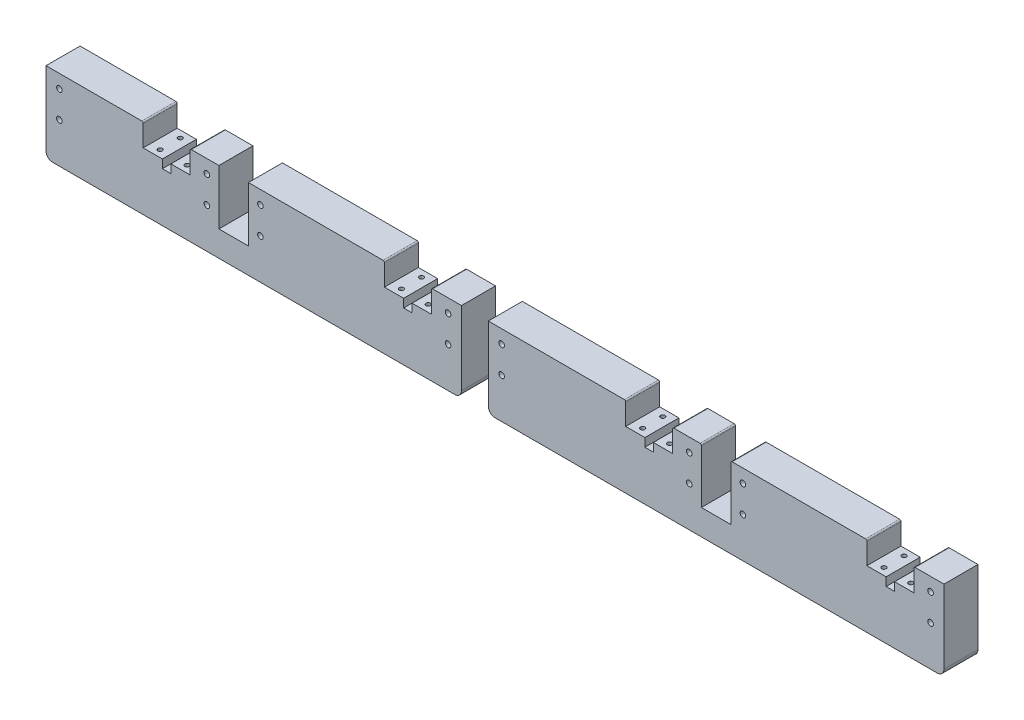
from build123d import *

# Parameters (mm, degrees)
BOSS_EXTRUDE1_DEPTH                  = 25.4
TAP_DRILL_FOR_M4X0_7_TAP1_AT_2_COUNT = 2
TAP_DRILL_FOR_M4X0_7_TAP1_AT_2_PITCH = 20
TAP_DRILL_FOR_M4X0_7_TAP1_AT_3_COUNT = 2
TAP_DRILL_FOR_M4X0_7_TAP1_AT_3_PITCH = 15
TAP_DRILL_FOR_M4X0_7_TAP1_AT_4_COUNT = 2
TAP_DRILL_FOR_M4X0_7_TAP1_AT_4_PITCH = 25
TAP_DRILL_FOR_M5X0_8_TAP3_D          = 4.2
LPATTERN5_COUNT                      = 4
LPATTERN5_PITCH                      = 180
CUT_EXTRUDE1_REACH                   = 643.752
SKETCH11_W                           = 50
SKETCH11_H                           = 60
SKETCH11_R                           = 2.1
SKETCH11_W_2                         = 22
SKETCH11_H_2                         = 42
CUT_EXTRUDE3_REACH                   = 593.9
SKETCH13_W                           = 20
SKETCH13_H                           = 10
SKETCH13_H_2                         = 50
FILLET1_R                            = 1
FILLET4_R                            = 1
FILLET2_R                            = 5
FILLET3_R                            = 5


with BuildPart() as part:
    # Sketch1 → Boss-Extrude1 (new body)
    with BuildSketch(Plane.XY):
        Polygon((22.5, 40), (-122.5, 40), (-122.5, 23.125), (-136.825, 23.125), (-136.825, 16.825), (-143.175, 16.825), (-143.175, 23.125), (-157.5, 23.125), (-157.5, 40), (-302.5, 40), (-302.5, 23.125), (-316.825, 23.125), (-316.825, 16.825), (-323.175, 16.825), (-323.175, 23.125), (-337.5, 23.125), (-337.5, 40), (-482.5, 40), (-482.5, 23.125), (-496.825, 23.125), (-496.825, 16.825), (-503.175, 16.825), (-503.175, 23.125), (-517.5, 23.125), (-517.5, 40), (-640, 40), (-640, -20), (80, -20), (80, 40), (57.5, 40), (57.5, 23.125), (43.175, 23.125), (43.175, 16.825), (36.825, 16.825), (36.825, 23.125), (22.5, 23.125), align=None)
    extrude(amount=-BOSS_EXTRUDE1_DEPTH)

    # Sketch9 → Tap Drill for M4x0.7 Tap1 (revolve, cut)
    with BuildSketch(Plane(origin=(30, 23.125, -5.2), x_dir=(0, 0, 1), z_dir=(1, 0, 0))):
        Polygon((0, 0), (0, 5.991420021), (1.65, 5), (1.65, 0), align=None)
    tap_drill_for_m4x0_7_tap1 = revolve(axis=Axis((30, 29.475, -5.2), (0, -1, 0)), mode=Mode.SUBTRACT)

    # Tap Drill for M4x0.7 Tap1 at 2: Tap Drill for M4x0.7 Tap1 ×2
    with Locations(*[(i * TAP_DRILL_FOR_M4X0_7_TAP1_AT_2_PITCH, 0, 0) for i in range(1, TAP_DRILL_FOR_M4X0_7_TAP1_AT_2_COUNT)]):
        add(tap_drill_for_m4x0_7_tap1, mode=Mode.SUBTRACT)

    # Tap Drill for M4x0.7 Tap1 at 3: Tap Drill for M4x0.7 Tap1 ×2
    with Locations(*[(0, 0, -i * TAP_DRILL_FOR_M4X0_7_TAP1_AT_3_PITCH) for i in range(1, TAP_DRILL_FOR_M4X0_7_TAP1_AT_3_COUNT)]):
        add(tap_drill_for_m4x0_7_tap1, mode=Mode.SUBTRACT)

    # Tap Drill for M4x0.7 Tap1 at 4: Tap Drill for M4x0.7 Tap1 ×2
    with Locations(*[Vector(0.8, 0, -0.6) * (i * TAP_DRILL_FOR_M4X0_7_TAP1_AT_4_PITCH) for i in range(1, TAP_DRILL_FOR_M4X0_7_TAP1_AT_4_COUNT)]):
        add(tap_drill_for_m4x0_7_tap1, mode=Mode.SUBTRACT)

    # Tap Drill for M5x0.8 Tap3 (through all)
    with Locations(Plane(origin=(-70, 30, 0), x_dir=(1, 0, 0), z_dir=(0, 0, 1))):
        with Locations((0, 0), (0, -20), (140, -20), (140, 0)):
            tap_drill_for_m5x0_8_tap3 = Hole(TAP_DRILL_FOR_M5X0_8_TAP3_D / 2)

    # LPattern5: Tap Drill for M4x0.7 Tap1, Tap Drill for M5x0.8 Tap3 ×4
    with Locations(*[(-i * LPATTERN5_PITCH, 0, 0) for i in range(1, LPATTERN5_COUNT)]):
        add(tap_drill_for_m4x0_7_tap1, mode=Mode.SUBTRACT)
        add(tap_drill_for_m5x0_8_tap3, mode=Mode.SUBTRACT)

    # LPattern5 copy 1 sketch → LPattern5 copy 1 (revolve, cut)
    with BuildSketch(Plane(origin=(-130, 23.125, -5.2), x_dir=(0, 0, 1), z_dir=(1, 0, 0))):
        Polygon((0, 0), (0, 5.991420021), (1.65, 5), (1.65, 0), align=None)
    revolve(axis=Axis((-130, 29.475, -5.2), (0, -1, 0)), mode=Mode.SUBTRACT)

    # LPattern5 copy 2 sketch → LPattern5 copy 2 (revolve, cut)
    with BuildSketch(Plane(origin=(-310, 23.125, -5.2), x_dir=(0, 0, 1), z_dir=(1, 0, 0))):
        Polygon((0, 0), (0, 5.991420021), (1.65, 5), (1.65, 0), align=None)
    revolve(axis=Axis((-310, 29.475, -5.2), (0, -1, 0)), mode=Mode.SUBTRACT)

    # LPattern5 copy 3 sketch → LPattern5 copy 3 (revolve, cut)
    with BuildSketch(Plane(origin=(-490, 23.125, -5.2), x_dir=(0, 0, 1), z_dir=(1, 0, 0))):
        Polygon((0, 0), (0, 5.991420021), (1.65, 5), (1.65, 0), align=None)
    revolve(axis=Axis((-490, 29.475, -5.2), (0, -1, 0)), mode=Mode.SUBTRACT)

    # LPattern5 copy 4 sketch → LPattern5 copy 4 (revolve, cut)
    with BuildSketch(Plane(origin=(-150, 23.125, -20.2), x_dir=(0, 0, 1), z_dir=(1, 0, 0))):
        Polygon((0, 0), (0, 5.991420021), (1.65, 5), (1.65, 0), align=None)
    revolve(axis=Axis((-150, 29.475, -20.2), (0, -1, 0)), mode=Mode.SUBTRACT)

    # LPattern5 copy 5 sketch → LPattern5 copy 5 (revolve, cut)
    with BuildSketch(Plane(origin=(-330, 23.125, -20.2), x_dir=(0, 0, 1), z_dir=(1, 0, 0))):
        Polygon((0, 0), (0, 5.991420021), (1.65, 5), (1.65, 0), align=None)
    revolve(axis=Axis((-330, 29.475, -20.2), (0, -1, 0)), mode=Mode.SUBTRACT)

    # LPattern5 copy 6 sketch → LPattern5 copy 6 (revolve, cut)
    with BuildSketch(Plane(origin=(-510, 23.125, -20.2), x_dir=(0, 0, 1), z_dir=(1, 0, 0))):
        Polygon((0, 0), (0, 5.991420021), (1.65, 5), (1.65, 0), align=None)
    revolve(axis=Axis((-510, 29.475, -20.2), (0, -1, 0)), mode=Mode.SUBTRACT)

    # LPattern5 copy 7 sketch → LPattern5 copy 7 (revolve, cut)
    with BuildSketch(Plane(origin=(-130, 23.125, -20.2), x_dir=(0, 0, 1), z_dir=(1, 0, 0))):
        Polygon((0, 0), (0, 5.991420021), (1.65, 5), (1.65, 0), align=None)
    revolve(axis=Axis((-130, 29.475, -20.2), (0, -1, 0)), mode=Mode.SUBTRACT)

    # LPattern5 copy 8 sketch → LPattern5 copy 8 (revolve, cut)
    with BuildSketch(Plane(origin=(-310, 23.125, -20.2), x_dir=(0, 0, 1), z_dir=(1, 0, 0))):
        Polygon((0, 0), (0, 5.991420021), (1.65, 5), (1.65, 0), align=None)
    revolve(axis=Axis((-310, 29.475, -20.2), (0, -1, 0)), mode=Mode.SUBTRACT)

    # LPattern5 copy 9 sketch → LPattern5 copy 9 (revolve, cut)
    with BuildSketch(Plane(origin=(-490, 23.125, -20.2), x_dir=(0, 0, 1), z_dir=(1, 0, 0))):
        Polygon((0, 0), (0, 5.991420021), (1.65, 5), (1.65, 0), align=None)
    revolve(axis=Axis((-490, 29.475, -20.2), (0, -1, 0)), mode=Mode.SUBTRACT)

    # Sketch11 → Cut-Extrude1 (cut, up to next)
    with BuildSketch(Plane.XY, mode=Mode.PRIVATE) as cut_extrude1_sk1:
        with Locations((-615, 10)):
            Rectangle(SKETCH11_W, SKETCH11_H)
    cut_extrude1_tool1 = extrude(cut_extrude1_sk1.sketch, amount=-CUT_EXTRUDE1_REACH, mode=Mode.PRIVATE) & part.part
    # Sketch11 → Cut-Extrude1 (cut, up to next)
    with BuildSketch(Plane.XY, mode=Mode.PRIVATE) as cut_extrude1_sk2:
        with Locations((-580, 30)):
            Circle(SKETCH11_R)
    cut_extrude1_tool2 = extrude(cut_extrude1_sk2.sketch, amount=-CUT_EXTRUDE1_REACH, mode=Mode.PRIVATE) & part.part
    # Sketch11 → Cut-Extrude1 (cut, up to next)
    with BuildSketch(Plane.XY, mode=Mode.PRIVATE) as cut_extrude1_sk3:
        with Locations((-580, 10)):
            Circle(SKETCH11_R)
    cut_extrude1_tool3 = extrude(cut_extrude1_sk3.sketch, amount=-CUT_EXTRUDE1_REACH, mode=Mode.PRIVATE) & part.part
    # Sketch11 → Cut-Extrude1 (cut, up to next)
    with BuildSketch(Plane.XY, mode=Mode.PRIVATE) as cut_extrude1_sk4:
        with Locations((-90, 20)):
            Rectangle(SKETCH11_W_2, SKETCH11_H_2)
    cut_extrude1_tool4 = extrude(cut_extrude1_sk4.sketch, amount=-CUT_EXTRUDE1_REACH, mode=Mode.PRIVATE) & part.part
    # Sketch11 → Cut-Extrude1 (cut, up to next)
    with BuildSketch(Plane.XY, mode=Mode.PRIVATE) as cut_extrude1_sk5:
        with Locations((-450, 20)):
            Rectangle(SKETCH11_W_2, SKETCH11_H_2)
    cut_extrude1_tool5 = extrude(cut_extrude1_sk5.sketch, amount=-CUT_EXTRUDE1_REACH, mode=Mode.PRIVATE) & part.part
    add(cut_extrude1_tool1.solids().sort_by_distance((-615, 10, 0))[0], mode=Mode.SUBTRACT)
    add(cut_extrude1_tool2.solids().sort_by_distance((-580, 30, 0))[0], mode=Mode.SUBTRACT)
    add(cut_extrude1_tool3.solids().sort_by_distance((-580, 10, 0))[0], mode=Mode.SUBTRACT)
    add(cut_extrude1_tool4.solids().sort_by_distance((-90, 20, 0))[0], mode=Mode.SUBTRACT)
    add(cut_extrude1_tool5.solids().sort_by_distance((-450, 20, 0))[0], mode=Mode.SUBTRACT)

    # Sketch13 → Cut-Extrude3 (cut, up to next)
    with BuildSketch(Plane.XY, mode=Mode.PRIVATE) as cut_extrude3_sk1:
        with Locations((-270, 35)):
            Rectangle(SKETCH13_W, SKETCH13_H)
    cut_extrude3_tool1 = extrude(cut_extrude3_sk1.sketch, amount=-CUT_EXTRUDE3_REACH, mode=Mode.PRIVATE) & part.part
    # Sketch13 → Cut-Extrude3 (cut, up to next)
    with BuildSketch(Plane.XY, mode=Mode.PRIVATE) as cut_extrude3_sk2:
        with Locations((-270, 5)):
            Rectangle(SKETCH13_W, SKETCH13_H_2)
    cut_extrude3_tool2 = extrude(cut_extrude3_sk2.sketch, amount=-CUT_EXTRUDE3_REACH, mode=Mode.PRIVATE) & part.part
    add(cut_extrude3_tool1.solids().sort_by_distance((-270, 35, 0))[0], mode=Mode.SUBTRACT)
    add(cut_extrude3_tool2.solids().sort_by_distance((-270, 5, 0))[0], mode=Mode.SUBTRACT)


with BuildPart() as cut_extrude3_piece_1:
    # of the separate pieces the step leaves, piece 1, a body of its own (cut_extrude3_pieces)
    add(part.part.solids().sort_by_distance((80, -20, 0))[0])

    # Fillet1
    fillet1_edges = [cut_extrude3_piece_1.edges().sort_by_distance(p)[0] for p in [
        (-101, 40, -12.7),
        (-79, 40, -12.7),
        (57.5, 40, -12.7),
        (-157.5, 40, -12.7),
        (-122.5, 40, -12.7),
        (22.5, 40, -12.7),
    ]]
    fillet(fillet1_edges, radius=FILLET1_R)

    # Fillet2
    fillet2_edges = [cut_extrude3_piece_1.edges().sort_by_distance(p)[0] for p in [
        (-260, -20, -12.7),
        (80, -20, -12.7),
    ]]
    fillet(fillet2_edges, radius=FILLET2_R)


with BuildPart() as cut_extrude3_piece_2:
    # of the separate pieces the step leaves, piece 2, a body of its own (cut_extrude3_pieces)
    add(part.part.solids().sort_by_distance((-590, -20, 0))[0])

    # Fillet4
    fillet4_edges = [cut_extrude3_piece_2.edges().sort_by_distance(p)[0] for p in [
        (-517.5, 40, -12.7),
        (-482.5, 40, -12.7),
        (-337.5, 40, -12.7),
        (-302.5, 40, -12.7),
    ]]
    fillet(fillet4_edges, radius=FILLET4_R)

    # Fillet3
    fillet3_edges = [cut_extrude3_piece_2.edges().sort_by_distance(p)[0] for p in [
        (-280, -20, -12.7),
        (-590, -20, -12.7),
    ]]
    fillet(fillet3_edges, radius=FILLET3_R)


solid = Compound([cut_extrude3_piece_1.part, cut_extrude3_piece_2.part])
